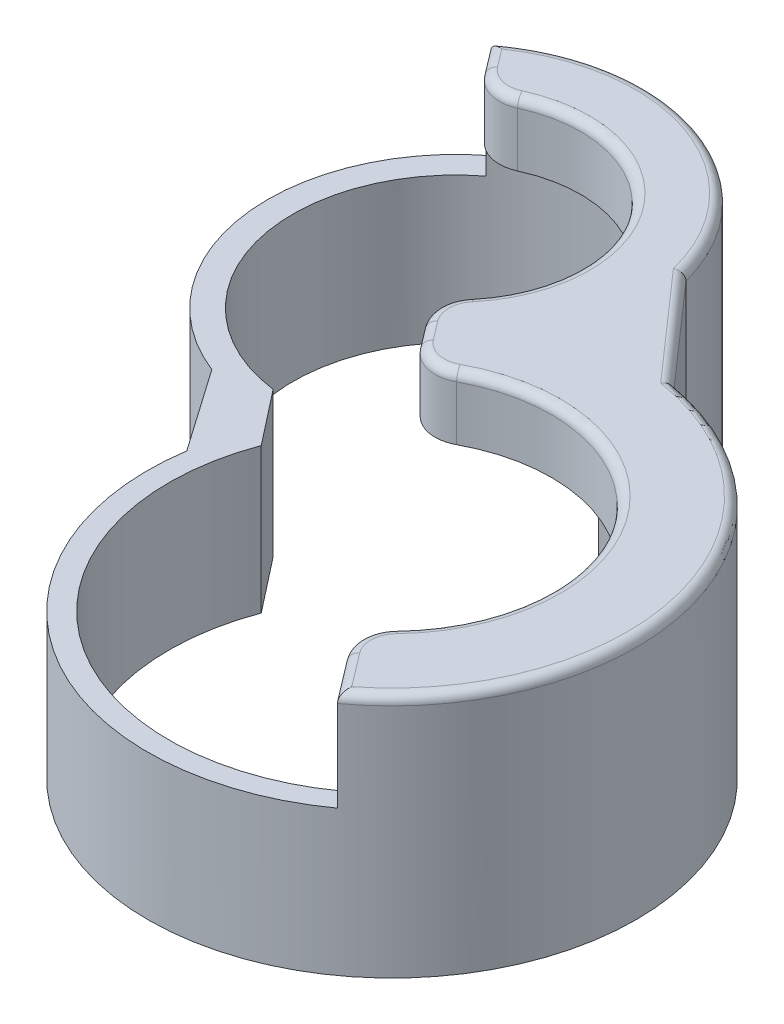
from build123d import *
from build123d.topology import SkipClean

# Parameters (mm, degrees)
SKETCH1_R                      = 12.3
SKETCH1_R_2                    = 11.45
SKETCH1_R_3                    = 9
SKETCH1_R_4                    = 8.15
BOSS_EXTRUDE4_DEPTH            = 59
SKETCH1_8_R                    = 5
BOSS_EXTRUDE17_DEPTH           = 10
BOSS_EXTRUDE17_DRAFT           = 1
BOSS_EXTRUDE17_PROFILE_2_DEPTH = 10
BOSS_EXTRUDE17_PROFILE_2_DRAFT = 1
BOSS_EXTRUDE19_DEPTH           = 59
SKETCH17_R                     = 11.45
SKETCH17_R_2                   = 8.15
BOSS_EXTRUDE20_DEPTH           = 3
SKETCH19_R                     = 3.2
CUT_EXTRUDE5_DEPTH             = 10
BOSS_EXTRUDE21_DEPTH           = 10
CUT_EXTRUDE8_DEPTH             = 66
CUT_EXTRUDE9_DEPTH             = 2
BOSS_EXTRUDE24_DEPTH           = 3.5
FILLET1_R                      = 2
FILLET2_R                      = 0.5


with BuildPart() as part:
    # Sketch1 → Boss-Extrude4 (new body)
    # profile 1 of 2: a face of its own
    with BuildSketch(Plane(origin=(0, 0, 0), x_dir=(1, 0, 0), z_dir=(0, 1, 0))):
        with Locations((35.202950653, 27.384819692)):
            Circle(SKETCH1_R)
        with Locations(Location((35.202950653, 27.384819692, 0), (0, 0, 270))):
            Circle(SKETCH1_R_2, mode=Mode.SUBTRACT)
    # profile 2 of 2: a face of its own
    with BuildSketch(Plane(origin=(0, 0, 0), x_dir=(1, 0, 0), z_dir=(0, 1, 0))):
        with Locations((22.493671705, 43.629178782)):
            Circle(SKETCH1_R_3)
        with Locations(Location((22.493671705, 43.629178782, 0), (0, 0, 270))):
            Circle(SKETCH1_R_4, mode=Mode.SUBTRACT)
    extrude(amount=BOSS_EXTRUDE4_DEPTH)

    # Sketch12 → Boss-Extrude19 (add)
    with SkipClean():  # the faces are left unmerged after this step: merging them gives an invalid solid
        with BuildSketch(Plane(origin=(0, 0, 0), x_dir=(-1, 0, 0), z_dir=(0, -1, 0))):
            with BuildLine():
                Line((-34.977539895, 38.8326007), (-30.605091655, 44.421243424))
                ThreePointArc((-30.605091655, 44.421243424), (-27.821958355, 37.462181021), (-20.532623065, 35.718629608))
                Line((-20.532623065, 35.718629608), (-24.304935413, 30.897050301))
                ThreePointArc((-24.304935413, 30.897050301), (-28.370974986, 36.573215009), (-34.977539895, 38.8326007))
            make_face()
        extrude(amount=-BOSS_EXTRUDE19_DEPTH)



with BuildPart() as body_2:
    # Sketch1<8> → Boss-Extrude17 (with draft: the straight prism first)
    with BuildSketch(Plane(origin=(0, 0, 0), x_dir=(1, 0, 0), z_dir=(0, 1, 0))):
        with Locations((22.493671705, 43.629178782)):
            Circle(SKETCH1_8_R)
    extrude(amount=BOSS_EXTRUDE17_DEPTH)
    # Boss-Extrude17: the draft: its side faces are tilted about the plane it starts from
    boss_extrude17_sides = [body_2.faces().sort_by_distance(p)[0] for p in [
        (17.493671705, 5, -43.629178782),
    ]]
    draft(boss_extrude17_sides, Plane(origin=(0, 0, 0), x_dir=(1, 0, 0), z_dir=(0, 1, 0)), BOSS_EXTRUDE17_DRAFT)


with BuildPart() as body_3:
    # Sketch1<8> → Boss-Extrude17 profile 2 (with draft: the straight prism first)
    with BuildSketch(Plane(origin=(0, 0, 0), x_dir=(1, 0, 0), z_dir=(0, 1, 0))):
        with Locations((35.202950653, 27.384819692)):
            Circle(SKETCH1_8_R)
    extrude(amount=BOSS_EXTRUDE17_PROFILE_2_DEPTH)
    # Boss-Extrude17 profile 2: the draft: its side faces are tilted about the plane it starts from
    boss_extrude17_profile_2_sides = [body_3.faces().sort_by_distance(p)[0] for p in [
        (30.202950653, 5, -27.384819692),
    ]]
    draft(boss_extrude17_profile_2_sides, Plane(origin=(0, 0, 0), x_dir=(1, 0, 0), z_dir=(0, 1, 0)), BOSS_EXTRUDE17_PROFILE_2_DRAFT)


with BuildPart() as part_1:
    with SkipClean():  # the faces are left unmerged after this step: merging them gives an invalid solid
        add(part.part)

        add(body_2.part)  # Boss-Extrude20 merges body 2

        add(body_3.part)  # Boss-Extrude20 merges body 3
        # Sketch17 → Boss-Extrude20 (add)
        with BuildSketch(Plane.XZ):
            with Locations(Location((35.202950653, -27.384819692, 0), (0, 0, 270))):
                Circle(SKETCH17_R)
            with Locations(Location((22.493671705, -43.629178782, 0), (0, 0, 270))):
                Circle(SKETCH17_R_2)
        extrude(amount=-BOSS_EXTRUDE20_DEPTH)

    # Sketch19 → Cut-Extrude5 (cut)
    with SkipClean():  # the faces are left unmerged after this step: merging them gives an invalid solid
        with BuildSketch(Plane(origin=(0, 0, 0), x_dir=(-1, 0, 0), z_dir=(0, -1, 0))):
            with Locations(Location((-35.202950653, 27.384819692, 0), (0, 0, 90))):
                Circle(SKETCH19_R)
            with Locations(Location((-22.493671705, 43.629178782, 0), (0, 0, 90))):
                Circle(SKETCH19_R)
        extrude(amount=-CUT_EXTRUDE5_DEPTH, mode=Mode.SUBTRACT)

    # Sketch35 → Cut-Extrude8 (cut)
    with BuildSketch(Plane.XZ):
        with BuildLine():
            Line((21.325413706, -34.705324611), (23.682144413, -31.693070334))
            ThreePointArc((23.682144413, -31.693070334), (42.566125739, -17.532223454), (34.334781161, -39.654142483))
            Line((34.334781161, -39.654142483), (31.487409842, -43.293508835))
            ThreePointArc((31.487409842, -43.293508835), (16.684303244, -50.503132381), (21.325413706, -34.705324611))
        make_face()
    extrude(amount=-CUT_EXTRUDE8_DEPTH, mode=Mode.SUBTRACT)


with BuildPart() as body_2_2:
    # Sketch23 → Boss-Extrude21 (new body)
    with BuildSketch(Plane(origin=(0, 59, 0), x_dir=(1, 0, 0), z_dir=(0, 1, 0))):
        with BuildLine():
            Line((37.468337272, 40.662183298), (32.546981676, 46.25595936))
            ThreePointArc((32.546981676, 46.25595936), (15.596937819, 51.401184911), (18.690039782, 33.959566495))
            Line((18.690039782, 33.959566495), (21.882803933, 29.3833322))
            ThreePointArc((21.882803933, 29.3833322), (43.099472085, 16.473114504), (37.468337272, 40.662183298))
        make_face()
        with BuildLine():
            ThreePointArc((21.325413706, 34.705324611), (16.684303244, 50.503132381), (31.487409842, 43.293508835))
            Line((31.487409842, 43.293508835), (34.334781161, 39.654142483))
            ThreePointArc((34.334781161, 39.654142483), (42.566125739, 17.532223454), (23.682144413, 31.693070334))
            Line((23.682144413, 31.693070334), (21.325413706, 34.705324611))
        make_face(mode=Mode.SUBTRACT)
    extrude(amount=BOSS_EXTRUDE21_DEPTH)

    # Sketch36 → Cut-Extrude9 (cut)
    with BuildSketch(Plane(origin=(0, 69, 0), x_dir=(1, 0, 0), z_dir=(0, 1, 0))):
        with BuildLine():
            Line((43.099472085, 16.473114504), (16.167051125, 51.87192648))
            ThreePointArc((16.167051125, 51.87192648), (12.204421781, 42.179919116), (18.690039782, 33.959566495))
            Line((18.690039782, 33.959566495), (21.882803933, 29.3833322))
            ThreePointArc((21.882803933, 29.3833322), (28.201353831, 15.878386587), (43.099472085, 16.473114504))
        make_face()
    extrude(amount=-CUT_EXTRUDE9_DEPTH, mode=Mode.SUBTRACT)

    # Sketch37 → Boss-Extrude24 (add)
    with BuildSketch(Plane(origin=(0, 69, 0), x_dir=(1, 0, 0), z_dir=(0, 1, 0))):
        with BuildLine():
            ThreePointArc((34.334781161, 39.654142483), (46.768156488, 31.572422107), (42.391274941, 17.403938272))
            Line((42.391274941, 17.403938272), (43.099472085, 16.473114504))
            ThreePointArc((43.099472085, 16.473114504), (48.321405443, 30.438752363), (37.468337272, 40.662183298))
            Line((37.468337272, 40.662183298), (32.546981676, 46.25595936))
            ThreePointArc((32.546981676, 46.25595936), (25.863660596, 53.45832892), (16.167051125, 51.87192648))
            Line((16.167051125, 51.87192648), (17.009199279, 50.765043285))
            ThreePointArc((17.009199279, 50.765043285), (26.620982357, 51.627010161), (31.487409842, 43.293508835))
            Line((31.487409842, 43.293508835), (34.334781161, 39.654142483))
        make_face()
        with BuildLine():
            Line((40.265515658, 20.197944547), (42.391274941, 17.403938272))
            ThreePointArc((42.391274941, 17.403938272), (46.768156488, 31.572422107), (34.334781161, 39.654142483))
            Line((34.334781161, 39.654142483), (31.487409842, 43.293508835))
            ThreePointArc((31.487409842, 43.293508835), (26.620982357, 51.627010161), (17.009199279, 50.765043285))
            Line((17.009199279, 50.765043285), (18.297152058, 49.072213728))
            ThreePointArc((18.297152058, 49.072213728), (25.526405421, 49.79683091), (29.366619149, 43.629178782))
            ThreePointArc((29.366619149, 43.629178782), (28.641776112, 40.557010367), (26.620135535, 38.132843382))
            Line((26.620135535, 38.132843382), (29.626833273, 34.180969615))
            ThreePointArc((29.626833273, 34.180969615), (38.962032304, 35.331519884), (43.993897063, 27.384819692))
            ThreePointArc((43.993897063, 27.384819692), (43.006330576, 23.336610142), (40.265515658, 20.197944547))
        make_face()
    extrude(amount=BOSS_EXTRUDE24_DEPTH)

    # Fillet1
    fillet1_edges = [body_2_2.edges().sort_by_distance(p)[0] for p in [
        (29.626833273, 70.75, -34.180969615),
        (40.265515658, 70.75, -20.197944547),
        (18.297152058, 70.75, -49.072213728),
        (26.620135535, 70.75, -38.132843382),
    ]]
    fillet(fillet1_edges, radius=FILLET1_R)

    # Fillet2
    fillet2_edges = [body_2_2.edges().sort_by_distance(p)[0] for p in [
        (42.199176887, 72.5, -32.707747202),
        (27.963469036, 72.5, -47.790755853),
        (28.095359601, 72.5, -36.193872526),
        (18.322601236, 72.5, -49.761580581),
        (27.291314439, 72.5, -37.973490947),
        (29.660488695, 72.5, -34.92920458),
        (40.995618754, 72.5, -20.030798741),
        (48.321405443, 72.5, -30.438752363),
        (35.007659474, 72.5, -43.459071329),
        (25.863660596, 72.5, -53.45832892),
        (16.692641456, 72.5, -51.181113228),
        (42.25007881, 72.5, -17.589520374),
    ]]
    fillet(fillet2_edges, radius=FILLET2_R)


solid = body_2_2.part
